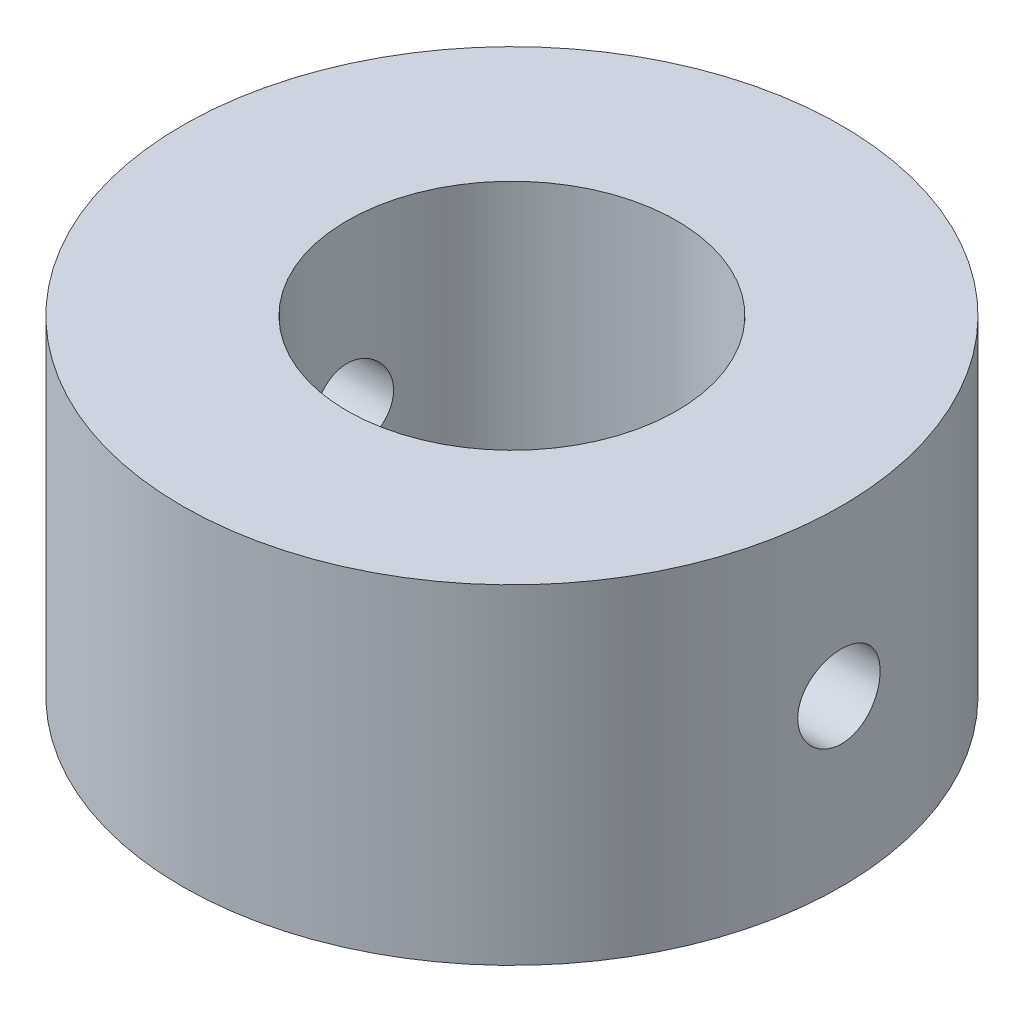
from build123d import *

# Parameters (mm, degrees)
SKETCH1_R               = 16
SKETCH1_R_2             = 8
BOSS_EXTRUDE1_DEPTH     = 16
CUT_EXTRUDE1_DEPTH      = 16
CUT_EXTRUDE1_DEPTH_BACK = 16
SKETCH2_R               = 2


with BuildPart() as part:
    # Sketch1 → Boss-Extrude1 (new body)
    with BuildSketch(Plane(origin=(0, 0, 0), x_dir=(1, 0, 0), z_dir=(0, 1, 0))):
        Circle(SKETCH1_R)
        Circle(SKETCH1_R_2, mode=Mode.SUBTRACT)
    extrude(amount=BOSS_EXTRUDE1_DEPTH)

    # Sketch2 → Cut-Extrude1 (cut, two sides: drawn at the far end of the back side and taken through both)
    with BuildSketch(Plane(origin=(0, 0, 0), x_dir=(0, 0, -1), z_dir=(1, 0, 0)).offset(-CUT_EXTRUDE1_DEPTH_BACK)):
        with Locations((0, 8)):
            Circle(SKETCH2_R)
    extrude(amount=CUT_EXTRUDE1_DEPTH + CUT_EXTRUDE1_DEPTH_BACK, mode=Mode.SUBTRACT)


solid = part.part
